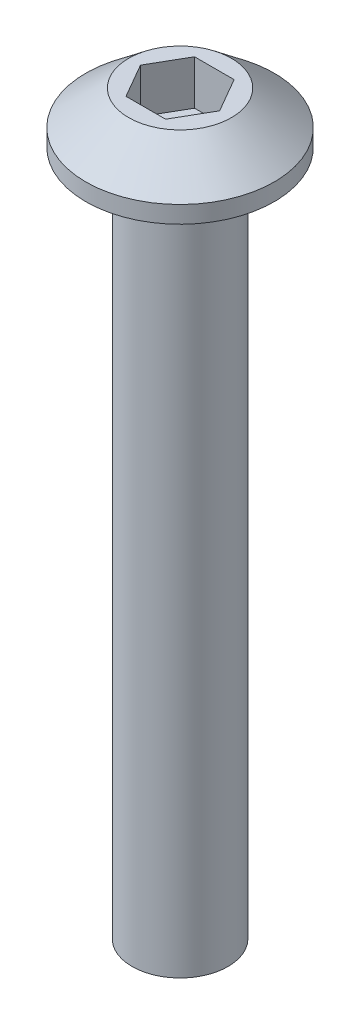
from build123d import *

# Parameters (mm, degrees)
SKETCH1_R           = 1.4
BOSS_EXTRUDE1_DEPTH = 20
SKETCH2_R           = 2.75
BOSS_EXTRUDE2_DEPTH = 1.5
CUT_EXTRUDE1_DEPTH  = 1.3


with BuildPart() as part:
    # Sketch1 → Boss-Extrude1 (new body)
    with BuildSketch(Plane(origin=(0, 0, 0), x_dir=(1, 0, 0), z_dir=(0, 1, 0))):
        with Locations(Location((0, 0, 0), (0, 0, 270))):
            Circle(SKETCH1_R)
    extrude(amount=BOSS_EXTRUDE1_DEPTH)

    # Sketch2 → Boss-Extrude2 (add)
    with BuildSketch(Plane(origin=(0, 20, 0), x_dir=(1, 0, 0), z_dir=(0, 1, 0))):
        with Locations(Location((0, 0, 0), (0, 0, 270))):
            Circle(SKETCH2_R)
    extrude(amount=BOSS_EXTRUDE2_DEPTH)

    # Sketch3 → Cut-Revolve1 (revolve, cut)
    with BuildSketch(Plane(origin=(0, 0, 0), x_dir=(0, 0, -1), z_dir=(1, 0, 0)), mode=Mode.PRIVATE) as cut_revolve1_sk:
        Polygon((1.5, 21.5), (2.75, 20.5), (2.75, 21.5), align=None)
    revolve(cut_revolve1_sk.sketch.rotate(Axis((0, 21.5, 0), (0, -1, 0)), 180), axis=Axis((0, 21.5, 0), (0, -1, 0)), mode=Mode.SUBTRACT)

    # Sketch4 → Cut-Extrude1 (cut)
    with BuildSketch(Plane(origin=(0, 21.5, 0), x_dir=(1, 0, 0), z_dir=(0, 1, 0))):
        Polygon((1.154700538, 0), (0.577350269, 1), (-0.577350269, 1), (-1.154700538, 0), (-0.577350269, -1), (0.577350269, -1), align=None)
    extrude(amount=-CUT_EXTRUDE1_DEPTH, mode=Mode.SUBTRACT)


solid = part.part
